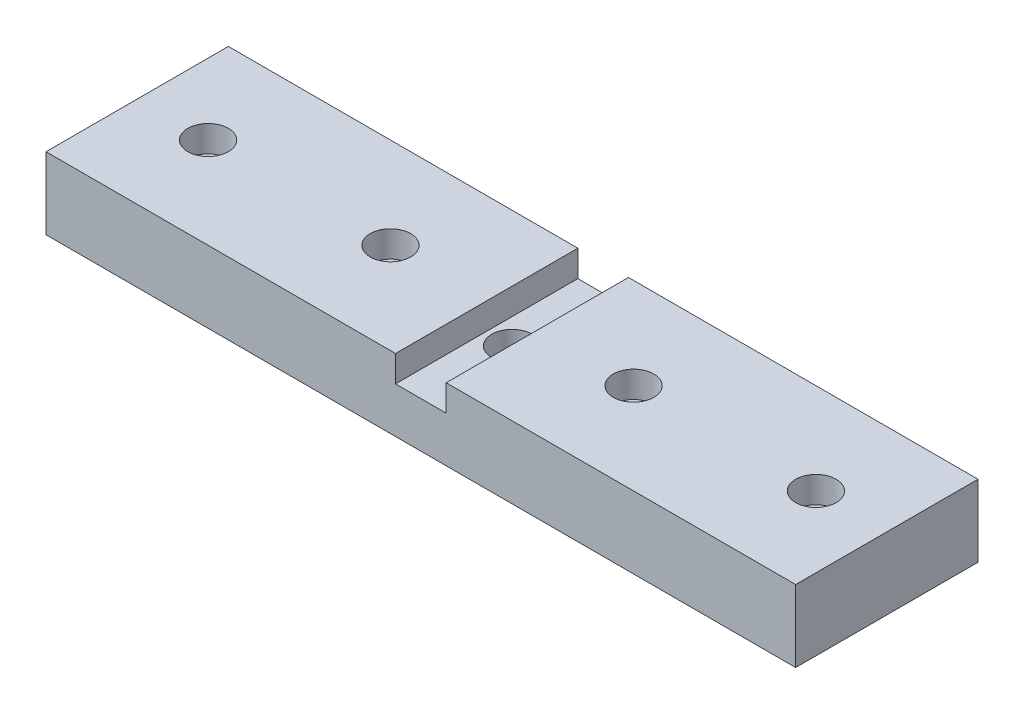
from build123d import *

# Parameters (mm, degrees)
SKETCH_1_W                          = 370
SKETCH_1_H                          = 90
EXTRUDE_1_DEPTH                     = 35.5
SKETCH_2_W                          = 25
SKETCH_2_H                          = 90
CUT_EXTRUDE_1_DEPTH                 = 13
HOLE_WIZARD_M4_1_D                  = 13.5
HOLE_WIZARD_M4_1_CBORE_D            = 20
HOLE_WIZARD_M4_1_CBORE_DEPTH        = 13
PATTERN_LINEAR_1_COUNT              = 2
PATTERN_LINEAR_1_PITCH              = 90
PATTERN_LINEAR_2_COPY_1_D           = 13.5
PATTERN_LINEAR_2_COPY_1_CBORE_D     = 20
PATTERN_LINEAR_2_COPY_1_CBORE_DEPTH = 13
PATTERN_LINEAR_3_COPY_1_D           = 13.5
PATTERN_LINEAR_3_COPY_1_CBORE_D     = 20
PATTERN_LINEAR_3_COPY_1_CBORE_DEPTH = 13
PATTERN_LINEAR_3_COPY_2_D           = 13.5
PATTERN_LINEAR_3_COPY_2_CBORE_D     = 20
PATTERN_LINEAR_3_COPY_2_CBORE_DEPTH = 13
HOLE_WIZARD_M4_2_D                  = 13.5
HOLE_WIZARD_M4_2_CBORE_D            = 20
HOLE_WIZARD_M4_2_CBORE_DEPTH        = 13


with BuildPart() as part:
    # 草图1 → 凸台-拉伸1 (new body)
    with BuildSketch(Plane(origin=(0, 0, 0), x_dir=(1, 0, 0), z_dir=(0, 1, 0))):
        Rectangle(SKETCH_1_W, SKETCH_1_H)
    extrude(amount=EXTRUDE_1_DEPTH)

    # 草图2 → 切除-拉伸1 (cut)
    with BuildSketch(Plane(origin=(0, 35.5, 0), x_dir=(1, 0, 0), z_dir=(0, 1, 0))):
        Rectangle(SKETCH_2_W, SKETCH_2_H)
    extrude(amount=-CUT_EXTRUDE_1_DEPTH, mode=Mode.SUBTRACT)

    # M4 六角头螺栓的柱形沉头孔1 (through all)
    with Locations(Plane(origin=(0, 35.5, 0), x_dir=(1, 0, 0), z_dir=(0, 1, 0))):
        with Locations((-150, 0)):
            hole_wizard_m4_1 = CounterBoreHole(HOLE_WIZARD_M4_1_D / 2, HOLE_WIZARD_M4_1_CBORE_D / 2, HOLE_WIZARD_M4_1_CBORE_DEPTH)

    # 阵列(线性)1: M4 六角头螺栓的柱形沉头孔1 ×2
    with Locations(*[(i * PATTERN_LINEAR_1_PITCH, 0, 0) for i in range(1, PATTERN_LINEAR_1_COUNT)]):
        add(hole_wizard_m4_1, mode=Mode.SUBTRACT)

    # 阵列(线性)2 copy 1 (through all)
    with Locations(Plane(origin=(210, 35.5, 0), x_dir=(1, 0, 0), z_dir=(0, 1, 0))):
        with Locations((-150, 0)):
            CounterBoreHole(PATTERN_LINEAR_2_COPY_1_D / 2, PATTERN_LINEAR_2_COPY_1_CBORE_D / 2, PATTERN_LINEAR_2_COPY_1_CBORE_DEPTH)

    # 阵列(线性)3 copy 1 (through all)
    with Locations(Plane(origin=(300, 35.5, 0), x_dir=(1, 0, 0), z_dir=(0, 1, 0))):
        with Locations((-150, 0)):
            CounterBoreHole(PATTERN_LINEAR_3_COPY_1_D / 2, PATTERN_LINEAR_3_COPY_1_CBORE_D / 2, PATTERN_LINEAR_3_COPY_1_CBORE_DEPTH)

    # 阵列(线性)3 copy 2 (through all)
    with Locations(Plane(origin=(90, 35.5, 0), x_dir=(1, 0, 0), z_dir=(0, 1, 0))):
        with Locations((-150, 0)):
            CounterBoreHole(PATTERN_LINEAR_3_COPY_2_D / 2, PATTERN_LINEAR_3_COPY_2_CBORE_D / 2, PATTERN_LINEAR_3_COPY_2_CBORE_DEPTH)

    # M4 六角头螺栓的柱形沉头孔2 (through all)
    with Locations(Plane(origin=(0, 22.5, 0), x_dir=(1, 0, 0), z_dir=(0, 1, 0))):
        with Locations((0, 0)):
            CounterBoreHole(HOLE_WIZARD_M4_2_D / 2, HOLE_WIZARD_M4_2_CBORE_D / 2, HOLE_WIZARD_M4_2_CBORE_DEPTH)


solid = part.part
